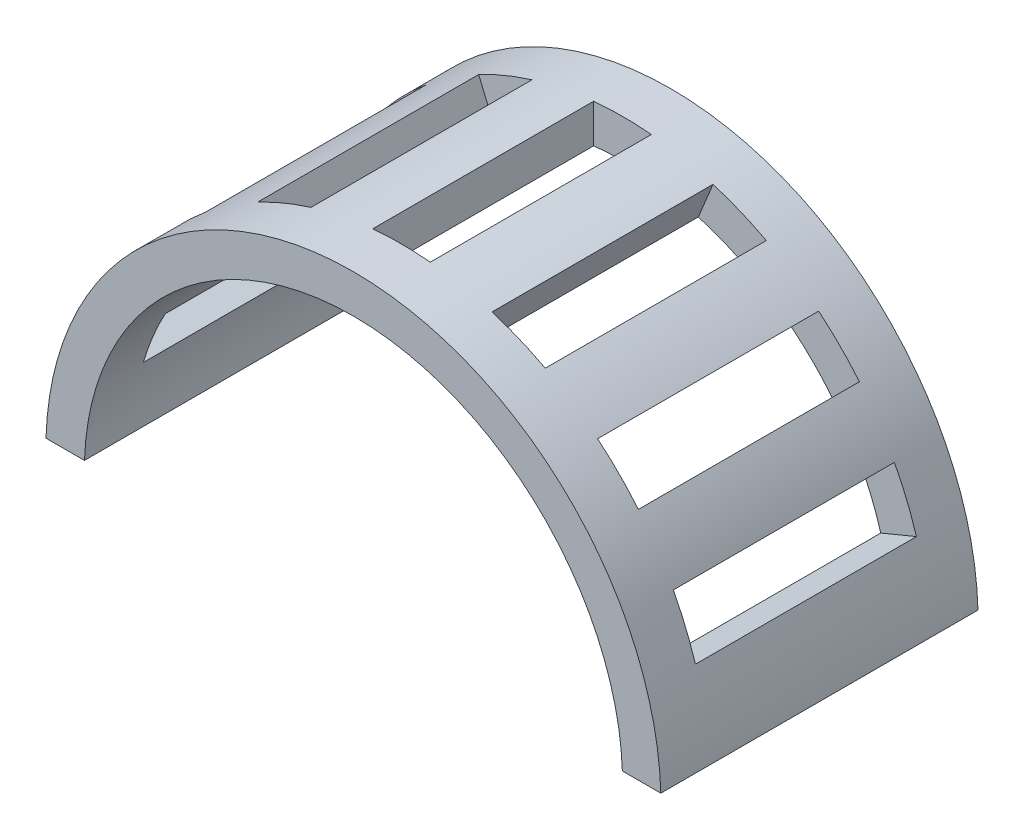
from build123d import *
from build123d.topology import SkipClean

# Parameters (mm, degrees)
BASE_EXTRUSION_DEPTH         = 16.5
ENL_V_MAT_EXTRU_1_DEPTH      = 5.75
R_P_TITION_CIRCULAIRE1_COUNT = 16
BOSS_EXTRU_1_REACH           = 30
BOSS_EXTRU_2_REACH           = 30


with BuildPart() as part:
    # Esquisse1 → Base-Extrusion (new body)
    with BuildSketch(Plane.XY):
        with BuildLine():
            Line((13.99106858, 0.5), (15.992185592, 0.5))
            ThreePointArc((15.992185592, 0.5), (0, 16), (-15.992185592, 0.5))
            Line((-15.992185592, 0.5), (-13.99106858, 0.5))
            ThreePointArc((-13.99106858, 0.5), (0, 14), (13.99106858, 0.5))
        make_face()
    extrude(amount=BASE_EXTRUSION_DEPTH)

    # Esquisse3 → Enlèv. mat.-Extru.1 (cut, symmetric)
    with BuildSketch(Plane.XY.offset(8.25)):
        with BuildLine():
            Line((1.5, 13.919410907), (1.5, 15.929532322))
            ThreePointArc((1.5, 15.929532322), (0, 16), (-1.5, 15.929532322))
            Line((-1.5, 15.929532322), (-1.5, 13.919410907))
            ThreePointArc((-1.5, 13.919410907), (0, 14), (1.5, 13.919410907))
        make_face()
    enl_v_mat_extru_1 = extrude(amount=ENL_V_MAT_EXTRU_1_DEPTH, both=True, mode=Mode.SUBTRACT)

    # Répétition circulaire1: Enlèv. mat.-Extru.1 ×16 about axis
    r_p_tition_circulaire1_axis = Axis((0, 0, 0), (0, 0, -1))
    for i in range(1, R_P_TITION_CIRCULAIRE1_COUNT):
        add(enl_v_mat_extru_1.rotate(r_p_tition_circulaire1_axis, i * 360 / R_P_TITION_CIRCULAIRE1_COUNT), mode=Mode.SUBTRACT)

    # Esquisse4 → Boss.-Extru.1 (add, up to next)
    with BuildSketch(Plane.XY.offset(16.5), mode=Mode.PRIVATE) as boss_extru_1_sk1:
        with BuildLine():
            Line((13.99106858, 0.5), (15.992185592, 0.5))
            ThreePointArc((15.992185592, 0.5), (15.915433276, 1.642858376), (15.757113358, 2.777297))
            Line((15.757113358, 2.777297), (13.787474188, 2.430134875))
            ThreePointArc((13.787474188, 2.430134875), (13.922758877, 1.468599763), (13.99106858, 0.5))
        make_face()
    boss_extru_1_tool1 = extrude(boss_extru_1_sk1.sketch, amount=-BOSS_EXTRU_1_REACH, mode=Mode.PRIVATE) - part.part
    add(boss_extru_1_tool1.solids().sort_by_distance((14.934064, 1.556829, 16.5))[0])

    # Esquisse5 → Boss.-Extru.2 (add, up to next)
    with BuildSketch(Plane.XY.offset(16.5), mode=Mode.PRIVATE) as boss_extru_2_sk1:
        with BuildLine():
            Line((-15.992185592, 0.5), (-13.99106858, 0.5))
            ThreePointArc((-13.99106858, 0.5), (-13.900842678, 1.663301788), (-13.714061824, 2.815050318))
            Line((-13.714061824, 2.815050318), (-15.673213513, 3.217200364))
            ThreePointArc((-15.673213513, 3.217200364), (-15.890883222, 1.865430361), (-15.992185592, 0.5))
        make_face()
    boss_extru_2_tool1 = extrude(boss_extru_2_sk1.sketch, amount=-BOSS_EXTRU_2_REACH, mode=Mode.PRIVATE) - part.part
    add(boss_extru_2_tool1.solids().sort_by_distance((-14.904552, 1.764949, 16.5))[0])


solid = part.part
